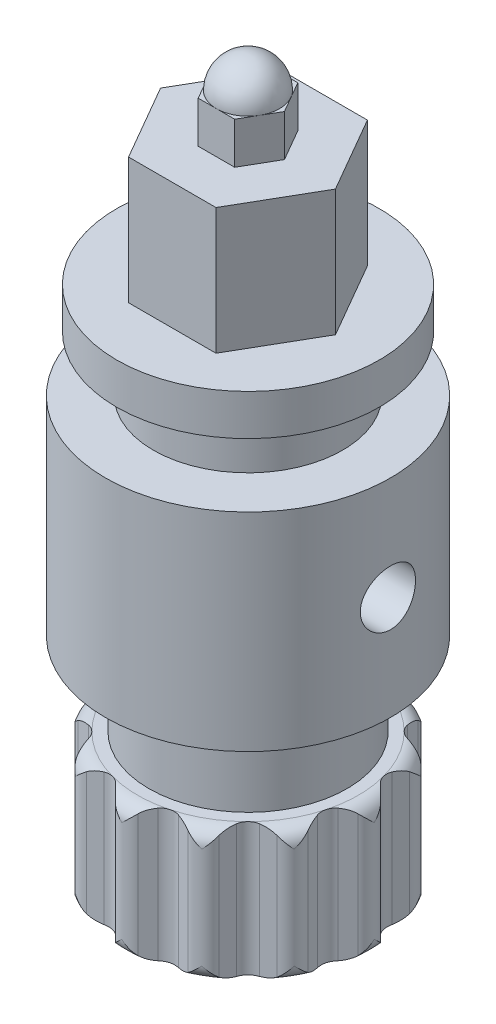
from build123d import *

# Parameters (mm, degrees)
TOP_HEX_DEPTH        = 8.382
MAIN_HEX_DEPTH       = 25.4
HANDLE_CUT_REACH     = 152.362
HANDLE_COUNT         = 12
NPTF_HOLE_DEPTH      = 124.606605058
NPTF_HOLE_DEPTH_BACK = 124.606605058
SKETCH5_R            = 5.55625


with BuildPart() as part:
    # Sketch1 → BASE (revolve)
    with BuildSketch(Plane(origin=(0, 0, 0), x_dir=(0, 0, -1), z_dir=(1, 0, 0))):
        with BuildLine():
            Line((-6.35, 110.401801724), (-6.35, 102.019801724))
            Line((-6.35, 102.019801724), (-15.24, 102.019801724))
            Line((-15.24, 102.019801724), (-15.24, 76.619801724))
            Line((-15.24, 76.619801724), (-26.416, 76.619801724))
            Line((-26.416, 76.619801724), (-26.416, 68.395276354))
            Line((-26.416, 68.395276354), (-19.05, 68.395276354))
            Line((-19.05, 68.395276354), (-19.05, 57.219276354))
            Line((-19.05, 57.219276354), (-28.702, 57.219276354))
            Line((-28.702, 57.219276354), (-28.702, 15.461676354))
            Line((-28.702, 15.461676354), (-19.939, 15.461676354))
            Line((-19.939, 15.461676354), (-19.939, -1.326289478))
            Line((-19.939, -1.326289478), (-22.225, -1.326289478))
            ThreePointArc((-22.225, -1.326289478), (-24.47006403, -2.256225447), (-25.4, -4.501289478))
            Line((-25.4, -4.501289478), (-25.4, -24.853198276))
            ThreePointArc((-25.4, -24.853198276), (-24.47006403, -27.098262306), (-22.225, -28.028198276))
            Line((-22.225, -28.028198276), (0, -28.028198276))
            Line((0, -28.028198276), (0, 116.751801724))
            ThreePointArc((0, 116.751801724), (-4.490128061, 114.891929785), (-6.35, 110.401801724))
        make_face()
    revolve(axis=Axis((0, 12.998642275, 0), (0, -1, 0)))

    # Sketch2 → TOP_HEX (add)
    with BuildSketch(Plane(origin=(0, 102.019801724, 0), x_dir=(1, 0, 0), z_dir=(0, 1, 0))):
        Polygon((3.666174209, 6.35), (-3.666174209, 6.35), (-7.332348419, 0), (-3.666174209, -6.35), (3.666174209, -6.35), (7.332348419, 0), align=None)
    extrude(amount=TOP_HEX_DEPTH)

    # Sketch3 → MAIN_HEX (add)
    with BuildSketch(Plane(origin=(0, 76.619801724, 0), x_dir=(1, 0, 0), z_dir=(0, 1, 0))):
        Polygon((17.597636205, 0), (8.798818102, 15.24), (-8.798818102, 15.24), (-17.597636205, 0), (-8.798818102, -15.24), (8.798818102, -15.24), align=None)
    extrude(amount=MAIN_HEX_DEPTH)

    # HANDLE_CUT: up to this face of the body (flat: up to its plane)
    handle_cut_end = Plane(part.part.faces().sort_by_distance((0, -1.326289478, -20.567617928))[0])
    # Sketch4 → HANDLE_CUT (cut, up to the picked face)
    with BuildSketch(Plane.XZ.offset(28.028198276), mode=Mode.PRIVATE) as handle_cut_sk1:
        with BuildLine():
            Line((2.296648631, 24.417265966), (4.277355115, 22.342250022))
            ThreePointArc((4.277355115, 22.342250022), (5.752253277, 21.467701489), (7.46682682, 21.487633654))
            Line((7.46682682, 21.487633654), (10.219676925, 22.294296933))
            ThreePointArc((10.219676925, 22.294296933), (11.490301069, 22.399856724), (12.7, 21.997045256))
            Line((12.7, 21.997045256), (13.49375, 23.371860585))
            ThreePointArc((13.49375, 23.371860585), (6.98487898, 26.067923237), (0, 26.9875))
            Line((0, 26.9875), (0, 25.4))
            ThreePointArc((0, 25.4), (1.24903574, 25.143995499), (2.296648631, 24.417265966))
        make_face()
    handle_cut_tool1 = split(extrude(handle_cut_sk1.sketch, amount=-HANDLE_CUT_REACH, mode=Mode.PRIVATE), bisect_by=handle_cut_end, keep=Keep.BOTH, mode=Mode.PRIVATE)
    handle_cut = handle_cut_tool1.solids().sort_by(Axis((6.481175, -28.028198, 24.188075), (0, 1, 0)))[0]
    add(handle_cut, mode=Mode.SUBTRACT)

    # HANDLE: HANDLE_CUT ×12 about axis
    handle_axis = Axis((0, 0, 0), (0, 1, 0))
    for i in range(1, HANDLE_COUNT):
        add(handle_cut.rotate(handle_axis, i * 360 / HANDLE_COUNT), mode=Mode.SUBTRACT)

    # Sketch5 → NPTF_HOLE (cut, two sides: drawn at the far end of the back side and taken through both)
    with BuildSketch(Plane(origin=(0, 0, 0), x_dir=(0, 0, -1), z_dir=(1, 0, 0)).offset(-NPTF_HOLE_DEPTH_BACK)):
        with Locations((0, 36.340476354)):
            Circle(SKETCH5_R)
    extrude(amount=NPTF_HOLE_DEPTH + NPTF_HOLE_DEPTH_BACK, mode=Mode.SUBTRACT)


solid = part.part
